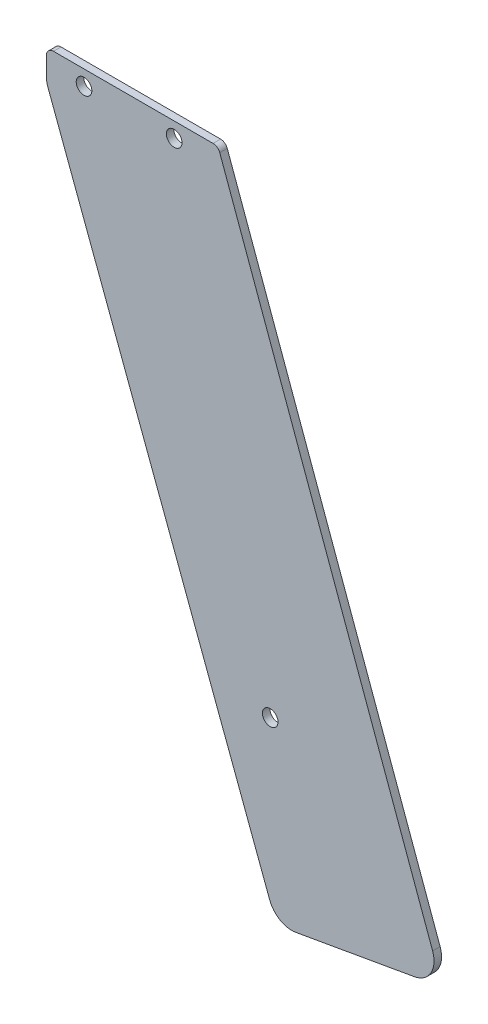
from build123d import *
from OCP.BRepFilletAPI import BRepFilletAPI_MakeFillet

# Parameters (mm, degrees)
SKETCH1_R           = 3.3
BOSS_EXTRUDE1_DEPTH = 3.175
FILLET1_R1          = 10
FILLET1_R2          = 3
SKETCH2_R           = 3.3
CUT_EXTRUDE1_DEPTH  = 312.546271304


with BuildPart() as part:
    # Sketch1 → Boss-Extrude1 (new body)
    with BuildSketch(Plane.XY):
        Polygon((72.5, 6.35), (167.244494596, -253.95835952), (97.244494596, -266.301248169), (0, -6.35), (0, 6.35), align=None)
        with Locations((53.975, 0)):
            Circle(SKETCH1_R, mode=Mode.SUBTRACT)
        with Locations((15.875, 0)):
            Circle(SKETCH1_R, mode=Mode.SUBTRACT)
    extrude(amount=BOSS_EXTRUDE1_DEPTH)

    # Fillet1: one fillet with a radius per group of edges: ONE call of the kernel's fillet builder (fillet() takes one radius for all edges)
    fillet1_edges_1 = [part.edges().sort_by_distance(p)[0] for p in [
        (167.244494596, -253.95835952, 1.5875),
        (97.244494596, -266.301248169, 1.5875),
        (0, -6.35, 1.5875),
    ]]
    fillet1_edges_2 = [part.edges().sort_by_distance(p)[0] for p in [
        (72.5, 6.35, 1.5875),
        (0, 6.35, 1.5875),
    ]]
    fillet1 = BRepFilletAPI_MakeFillet(part.part.solid().wrapped)
    for e in fillet1_edges_1:
        fillet1.Add(FILLET1_R1, e.wrapped)
    for e in fillet1_edges_2:
        fillet1.Add(FILLET1_R2, e.wrapped)
    add(Compound.cast(fillet1.Shape()), mode=Mode.REPLACE)

    # Sketch2 → Cut-Extrude1 (cut, through all)
    with BuildSketch(Plane.XY.offset(3.175)):
        with Locations((94.53593378, -191.691292203)):
            Circle(SKETCH2_R)
    extrude(amount=-CUT_EXTRUDE1_DEPTH, mode=Mode.SUBTRACT)


solid = part.part
